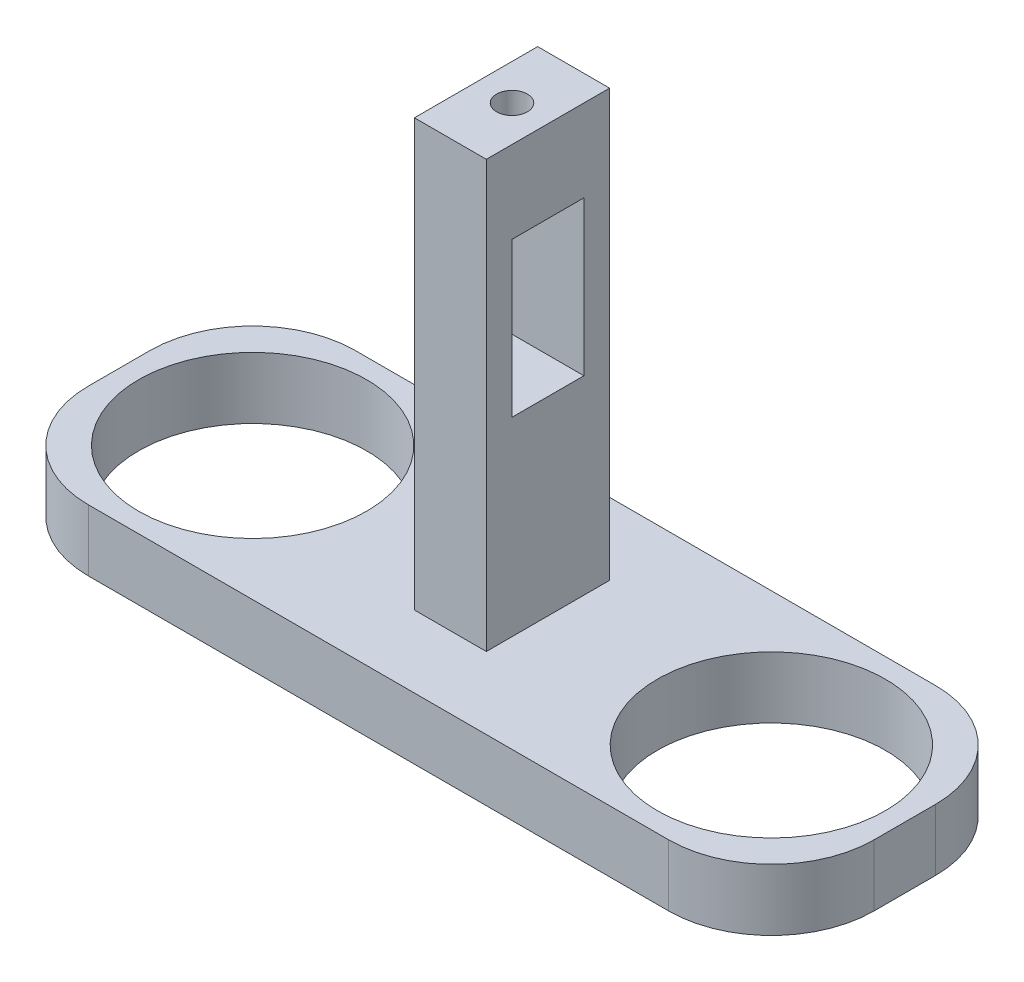
from build123d import *

# Parameters (mm, degrees)
SKETCH_1_W             = 41.75
SKETCH_1_H             = 26
EXTRUDE_1_DEPTH        = 6
SKETCH_2_R             = 11.1
CUT_EXTRUDE_1_DEPTH    = 6
SKETCH_3_W             = 7
SKETCH_3_H             = 12
EXTRUDE_2_DEPTH        = 41.5
SKETCH_4_W             = 7
SKETCH_4_H             = 15
CUT_EXTRUDE_2_DEPTH    = 7
FILLET_1_R             = 10
FILLET_1_OF_MIRROR_1_R = 10
SKETCH_5_R             = 1.5
CUT_EXTRUDE_4_DEPTH    = 8


with BuildPart() as part:
    # Эскиз1 → Бобышка-Вытянуть1 (new body)
    with BuildSketch(Plane(origin=(0, 0, 0), x_dir=(1, 0, 0), z_dir=(0, 1, 0))):
        Rectangle(SKETCH_1_W, SKETCH_1_H)
    extrude_1 = extrude(amount=EXTRUDE_1_DEPTH)

    # Эскиз2 → Вырез-Вытянуть1 (cut)
    with BuildSketch(Plane(origin=(0, 6, 0), x_dir=(1, 0, 0), z_dir=(0, 1, 0))):
        with Locations(Location((7.875, 0, 0), (0, 0, 270))):
            Circle(SKETCH_2_R)
    cut_extrude_1 = extrude(amount=-CUT_EXTRUDE_1_DEPTH, mode=Mode.SUBTRACT)

    # Эскиз3 → Бобышка-Вытянуть2 (add)
    with BuildSketch(Plane(origin=(0, 6, 0), x_dir=(1, 0, 0), z_dir=(0, 1, 0))):
        with Locations((-17.375, 0)):
            Rectangle(SKETCH_3_W, SKETCH_3_H)
    extrude_2 = extrude(amount=EXTRUDE_2_DEPTH)

    # Эскиз4 → Вырез-Вытянуть2 (cut)
    with BuildSketch(Plane.ZY.offset(20.875)):
        with Locations((0, 32)):
            Rectangle(SKETCH_4_W, SKETCH_4_H)
    cut_extrude_2 = extrude(amount=-CUT_EXTRUDE_2_DEPTH, mode=Mode.SUBTRACT)

    # Скругление1
    fillet_1_edges = [part.edges().sort_by_distance(p)[0] for p in [
        (20.875, 3, 13),
        (20.875, 3, -13),
    ]]
    fillet(fillet_1_edges, radius=FILLET_1_R)

    # Зеркальное отражение1: Бобышка-Вытянуть1, Вырез-Вытянуть1, Бобышка-Вытянуть2, Вырез-Вытянуть2 across plane
    add(extrude_1.mirror(Plane.ZY.offset(17.375)))
    add(cut_extrude_1.mirror(Plane.ZY.offset(17.375)), mode=Mode.SUBTRACT)
    add(extrude_2.mirror(Plane.ZY.offset(17.375)))
    add(cut_extrude_2.mirror(Plane.ZY.offset(17.375)), mode=Mode.SUBTRACT)

    # Скругление1 of Зеркальное отражение1
    fillet_1_of_mirror_1_edges = [part.edges().sort_by_distance(p)[0] for p in [
        (-55.625, 3, 13),
        (-55.625, 3, -13),
    ]]
    fillet(fillet_1_of_mirror_1_edges, radius=FILLET_1_OF_MIRROR_1_R)

    # Эскиз5 → Вырез-Вытянуть4 (cut)
    with BuildSketch(Plane(origin=(0, 47.5, 0), x_dir=(1, 0, 0), z_dir=(0, 1, 0))):
        with Locations(Location((-17.375, 0, 0), (0, 0, 270))):
            Circle(SKETCH_5_R)
    extrude(amount=-CUT_EXTRUDE_4_DEPTH, mode=Mode.SUBTRACT)


solid = part.part
